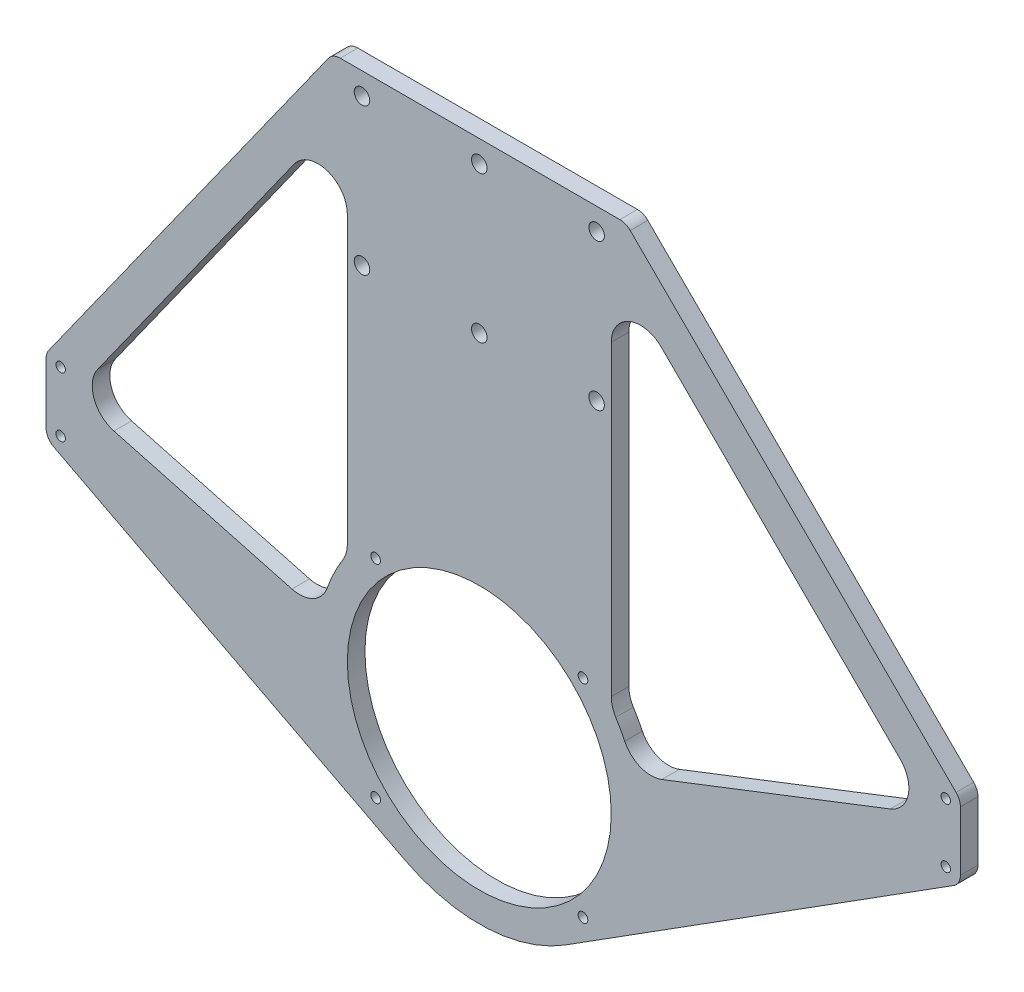
from build123d import *

# Parameters (mm, degrees)
SKETCH8_R           = 45
SKETCH8_R_2         = 2.65
BOSS_EXTRUDE4_DEPTH = 6
SKETCH9_R           = 1.65
CUT_EXTRUDE1_DEPTH  = 242.418521502
CUT_EXTRUDE2_DEPTH  = 242.418521502
FILLET2_R           = 10
FILLET3_R           = 5
SKETCH11_R          = 1.6
CUT_EXTRUDE3_DEPTH  = 242.418521502


with BuildPart() as part:
    # Sketch8 → Boss-Extrude4 (new body)
    with BuildSketch(Plane.XY):
        with BuildLine():
            Line((50, 177), (-50, 177))
            Line((-50, 177), (-147.758969873, 39.702478789))
            Line((-147.758969873, 39.702478789), (-147.758969873, 14.702478789))
            Line((-147.758969873, 14.702478789), (-25.330258141, -48.81985275))
            ThreePointArc((-25.330258141, -48.81985275), (2.348008246, -54.949857664), (29.402470247, -46.481122441))
            Line((29.402470247, -46.481122441), (164.066762399, 38.703198318))
            Line((164.066762399, 38.703198318), (164.066762399, 63.703198318))
            Line((164.066762399, 63.703198318), (50, 177))
        make_face()
        Circle(SKETCH8_R, mode=Mode.SUBTRACT)
        with Locations((-40, 169.5)):
            Circle(SKETCH8_R_2, mode=Mode.SUBTRACT)
        with Locations((40, 169.5)):
            Circle(SKETCH8_R_2, mode=Mode.SUBTRACT)
        with Locations((0, 169.5)):
            Circle(SKETCH8_R_2, mode=Mode.SUBTRACT)
        with Locations((40, 119.5)):
            Circle(SKETCH8_R_2, mode=Mode.SUBTRACT)
        with Locations((0, 119.5)):
            Circle(SKETCH8_R_2, mode=Mode.SUBTRACT)
        with Locations((-40, 119.5)):
            Circle(SKETCH8_R_2, mode=Mode.SUBTRACT)
    extrude(amount=BOSS_EXTRUDE4_DEPTH)

    # Sketch9 → Cut-Extrude1 (cut, through all)
    with BuildSketch(Plane(origin=(0, 0, 0), x_dir=(-1, 0, 0), z_dir=(0, 0, -1))):
        with Locations((35.355339059, -35.355339059)):
            Circle(SKETCH9_R)
        with Locations((-35.355339059, -35.355339059)):
            Circle(SKETCH9_R)
        with Locations((-35.355339059, 35.355339059)):
            Circle(SKETCH9_R)
        with Locations((35.355339059, 35.355339059)):
            Circle(SKETCH9_R)
    extrude(amount=-CUT_EXTRUDE1_DEPTH, mode=Mode.SUBTRACT)

    # Sketch10 → Cut-Extrude2 (cut, through all)
    with BuildSketch(Plane(origin=(0, 0, 0), x_dir=(-1, 0, 0), z_dir=(0, 0, -1))):
        with BuildLine():
            Line((45, 31.622776602), (45, 163.333195837))
            Line((45, 163.333195837), (138.48799676, 32.034040017))
            Line((138.48799676, 32.034040017), (54.193493342, 9.38431028))
            ThreePointArc((54.193493342, 9.38431028), (50.827892209, 21.012505171), (45, 31.622776602))
        make_face()
        with BuildLine():
            Line((-52.868310579, 15.163829877), (-154.461888015, 54.610185231))
            Line((-154.461888015, 54.610185231), (-45, 163.333195837))
            Line((-45, 163.333195837), (-45, 31.622776602))
            ThreePointArc((-45, 31.622776602), (-49.621323901, 23.721808833), (-52.868310579, 15.163829877))
        make_face()
    extrude(amount=-CUT_EXTRUDE2_DEPTH, mode=Mode.SUBTRACT)

    # Fillet2
    fillet2_edges = [part.edges().sort_by_distance(p)[0] for p in [
        (-54.193493342, 9.38431028, 3),
        (-45, 31.622776602, 3),
        (52.868310579, 15.163829877, 3),
        (45, 31.622776602, 3),
        (154.461888015, 54.610185231, 3),
        (-138.48799676, 32.034040017, 3),
        (45, 163.333195837, 3),
        (-45, 163.333195837, 3),
    ]]
    fillet(fillet2_edges, radius=FILLET2_R)

    # Fillet3
    fillet3_edges = [part.edges().sort_by_distance(p)[0] for p in [
        (164.066762399, 38.703198318, 3),
        (164.066762399, 63.703198318, 3),
        (-147.758969873, 14.702478789, 3),
        (-147.758969873, 39.702478789, 3),
        (50, 177, 3),
        (-50, 177, 3),
    ]]
    fillet(fillet3_edges, radius=FILLET3_R)

    # Sketch11 → Cut-Extrude3 (cut, through all)
    with BuildSketch(Plane(origin=(0, 0, 0), x_dir=(-1, 0, 0), z_dir=(0, 0, -1))):
        with Locations((142.758969873, 38.104287644)):
            Circle(SKETCH11_R)
        with Locations((142.758969873, 17.741175158)):
            Circle(SKETCH11_R)
        with Locations((-159.066762399, 61.622204822)):
            Circle(SKETCH11_R)
        with Locations((-159.066762399, 41.456738724)):
            Circle(SKETCH11_R)
    extrude(amount=-CUT_EXTRUDE3_DEPTH, mode=Mode.SUBTRACT)


solid = part.part
